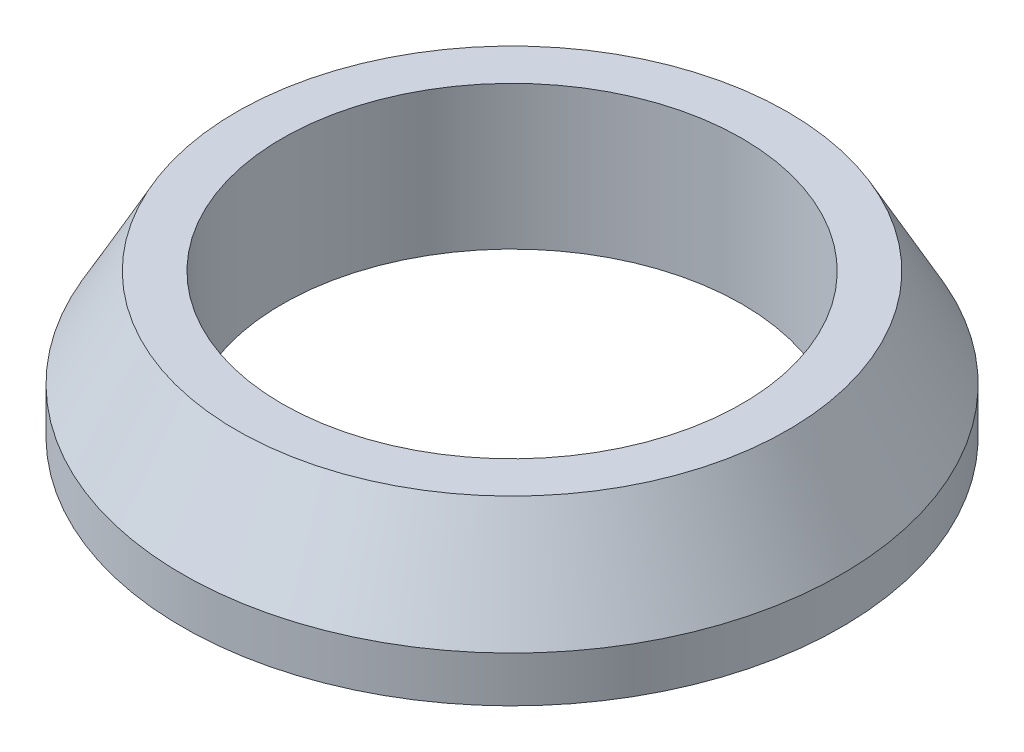
from build123d import *


with BuildPart() as part:
    # Sketch1 → Revolve1 (revolve)
    with BuildSketch(Plane.XY, mode=Mode.PRIVATE) as revolve1_sk:
        Polygon((6.3881, 0), (9.1567, 0), (9.1567, 1.27), (7.6581, 3.9878), (6.3881, 3.9878), align=None)
    revolve(revolve1_sk.sketch.rotate(Axis((0, 0, 0), (0, 1, 0)), 90), axis=Axis((0, 0, 0), (0, 1, 0)))


solid = part.part
